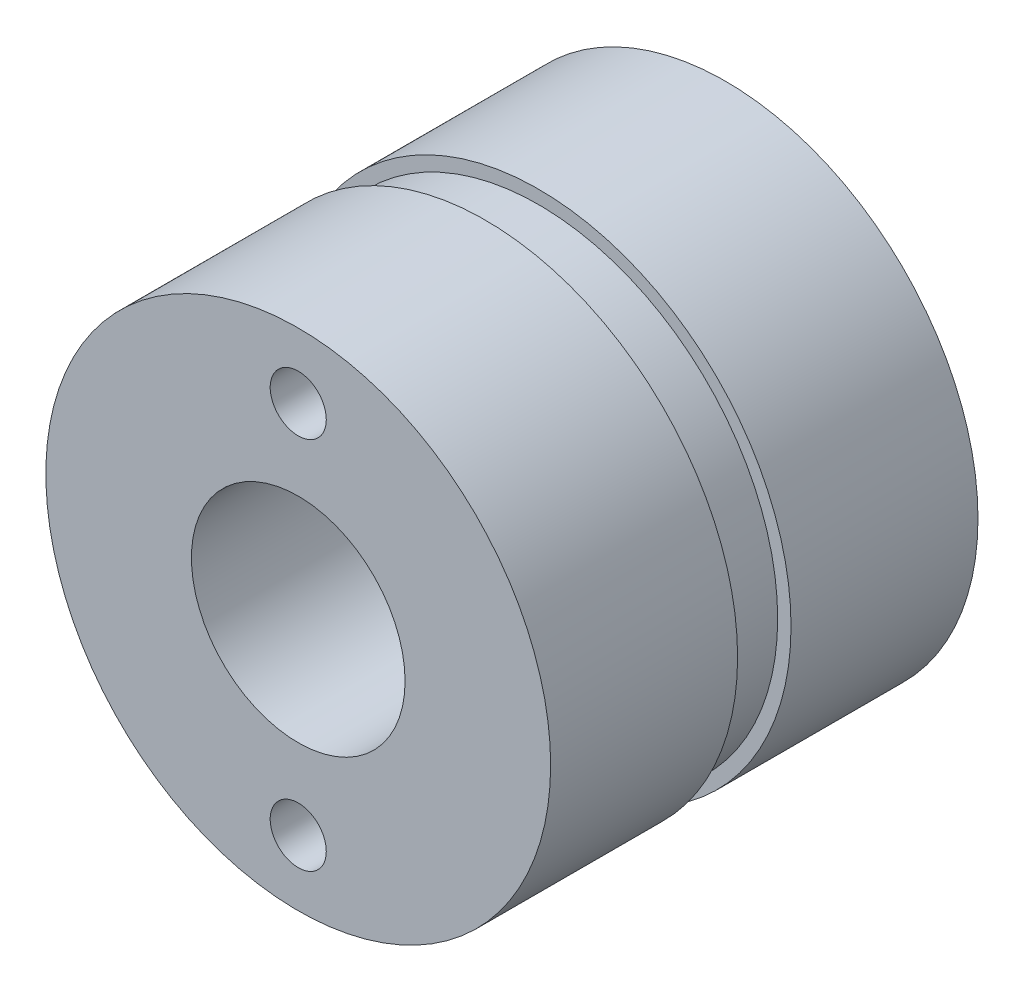
from build123d import *

# Parameters (mm, degrees)
SKETCH1_R                    = 9.45
BOSS_EXTRUDE1_DEPTH          = 7
SKETCH2_R                    = 8.95
BOSS_EXTRUDE2_DEPTH          = 2
SKETCH3_R                    = 9.45
BOSS_EXTRUDE3_DEPTH          = 7
SKETCH4_R                    = 4
CUT_EXTRUDE1_DEPTH           = 21.847182064
M2_5X0_45_TAPPED_HOLE1_D     = 2.1
M2_5X0_45_TAPPED_HOLE1_DEPTH = 7
M2_5X0_45_TAPPED_HOLE1_TIP   = 0.63090365
M2_5X0_45_TAPPED_HOLE2_D     = 2.1
M2_5X0_45_TAPPED_HOLE2_DEPTH = 7
M2_5X0_45_TAPPED_HOLE2_TIP   = 0.63090365


with BuildPart() as part:
    # Sketch1 → Boss-Extrude1 (new body)
    with BuildSketch(Plane.XY):
        Circle(SKETCH1_R)
    extrude(amount=BOSS_EXTRUDE1_DEPTH)

    # Sketch2 → Boss-Extrude2 (add)
    with BuildSketch(Plane.XY.offset(7)):
        Circle(SKETCH2_R)
    extrude(amount=BOSS_EXTRUDE2_DEPTH)

    # Sketch3 → Boss-Extrude3 (add)
    with BuildSketch(Plane.XY.offset(9)):
        Circle(SKETCH3_R)
    extrude(amount=BOSS_EXTRUDE3_DEPTH)

    # Sketch4 → Cut-Extrude1 (cut, through all)
    with BuildSketch(Plane.XY.offset(16)):
        Circle(SKETCH4_R)
    extrude(amount=-CUT_EXTRUDE1_DEPTH, mode=Mode.SUBTRACT)

    # M2.5x0.45 Tapped Hole1
    with Locations(Plane.XY.offset(16)):
        with Locations((0, -7), (0, 7)):
            Hole(M2_5X0_45_TAPPED_HOLE1_D / 2, depth=M2_5X0_45_TAPPED_HOLE1_DEPTH)
            with Locations((0, 0, -(M2_5X0_45_TAPPED_HOLE1_DEPTH + M2_5X0_45_TAPPED_HOLE1_TIP / 2))):  # 118° drill point
                Cone(0, M2_5X0_45_TAPPED_HOLE1_D / 2, M2_5X0_45_TAPPED_HOLE1_TIP, mode=Mode.SUBTRACT)

    # M2.5x0.45 Tapped Hole2
    with Locations(Plane(origin=(0, 0, 0), x_dir=(-1, 0, 0), z_dir=(0, 0, -1))):
        with Locations((0, 7), (0, -7)):
            Hole(M2_5X0_45_TAPPED_HOLE2_D / 2, depth=M2_5X0_45_TAPPED_HOLE2_DEPTH)
            with Locations((0, 0, -(M2_5X0_45_TAPPED_HOLE2_DEPTH + M2_5X0_45_TAPPED_HOLE2_TIP / 2))):  # 118° drill point
                Cone(0, M2_5X0_45_TAPPED_HOLE2_D / 2, M2_5X0_45_TAPPED_HOLE2_TIP, mode=Mode.SUBTRACT)


solid = part.part
